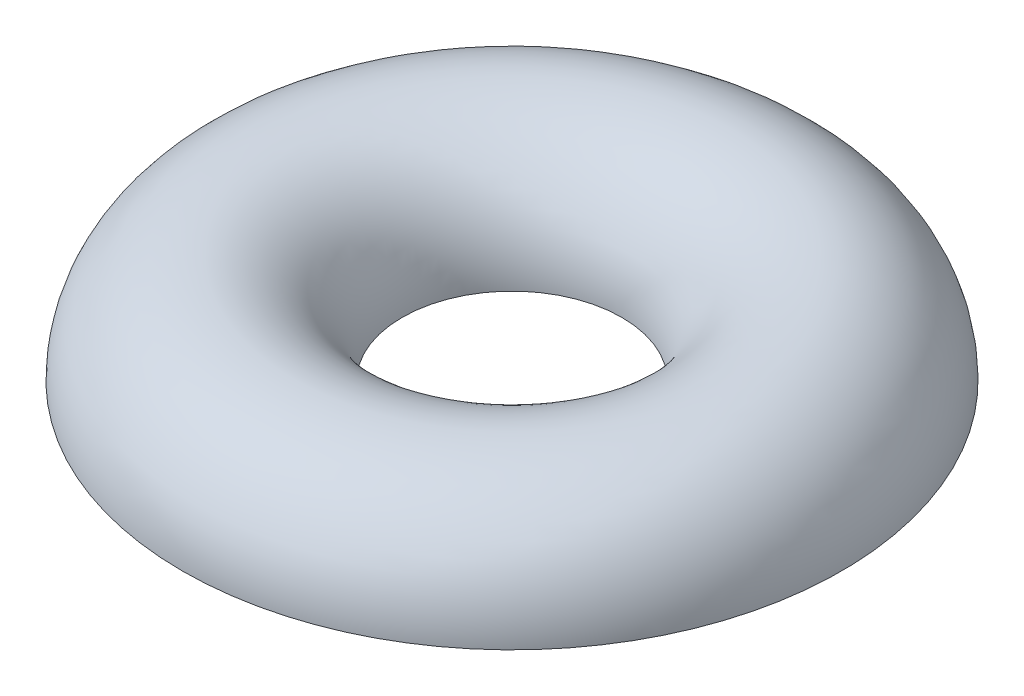
from build123d import *

# Parameters (mm, degrees)
SKETCH1_R               = 25.4
CUT_EXTRUDE1_DEPTH      = 111.716033327
CUT_EXTRUDE1_DEPTH_BACK = 111.716033327
SKETCH2_W               = 159.238420365
SKETCH2_H               = 33.394571585


with BuildPart() as part:
    # Sketch1 → Base-Revolve (revolve)
    with BuildSketch(Plane.XY):
        with Locations((50.8, 0)):
            Circle(SKETCH1_R)
    revolve(axis=Axis((0, 70.114951321, 0), (0, -1, 0)))

    # Sketch2 → Cut-Extrude1 (cut, two sides: drawn at the far end of the back side and taken through both)
    with BuildSketch(Plane.XY.offset(-CUT_EXTRUDE1_DEPTH_BACK)):
        with Locations((-0.363973533, -16.697285793)):
            Rectangle(SKETCH2_W, SKETCH2_H)
    extrude(amount=CUT_EXTRUDE1_DEPTH + CUT_EXTRUDE1_DEPTH_BACK, mode=Mode.SUBTRACT)


solid = part.part
